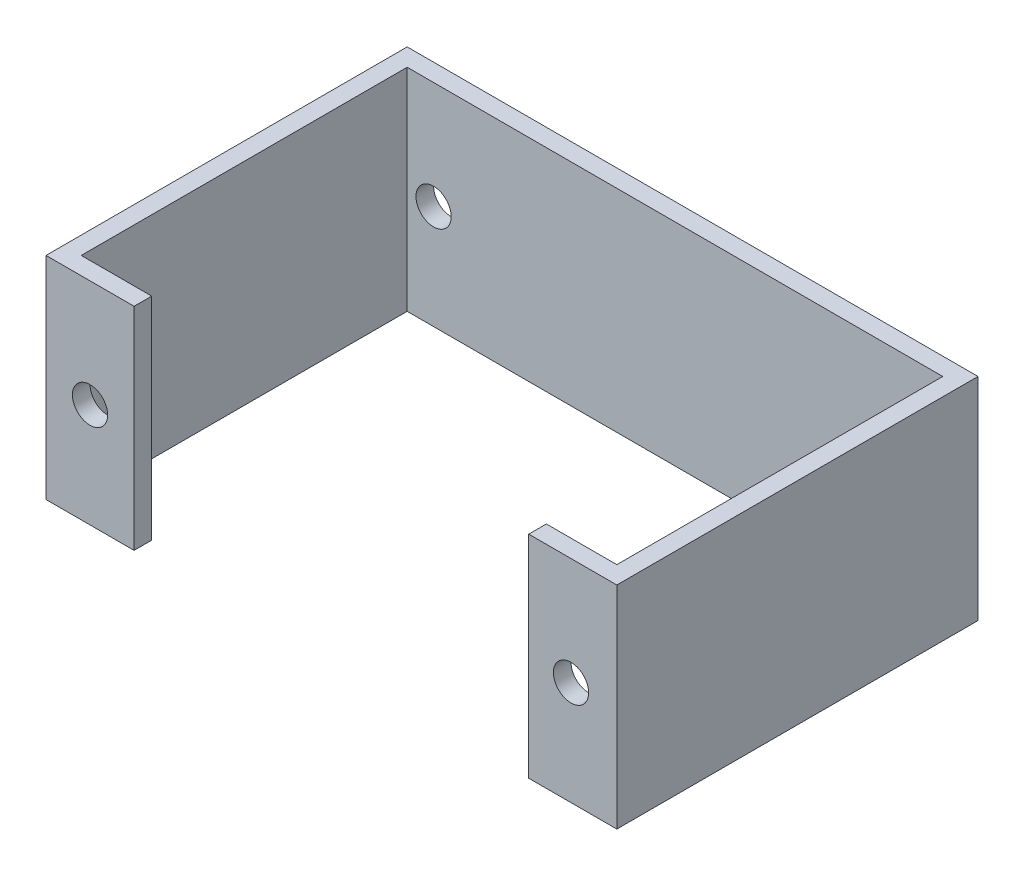
from build123d import *

# Parameters (mm, degrees)
EXTRUDE_THIN1_DEPTH = 12
SKETCH4_R           = 1
CUT_EXTRUDE2_DEPTH  = 40.372706282


with BuildPart() as part:
    # Sketch2 → Extrude-Thin1 (new body)
    with BuildSketch(Plane(origin=(0, 0, 0), x_dir=(1, 0, 0), z_dir=(0, 1, 0))):
        Polygon((4, -18.5), (0, -18.5), (0, 0), (30.4, 0), (30.4, -18.5), (26.4, -18.5), (26.4, -19.5), (31.4, -19.5), (31.4, 1), (-1, 1), (-1, -19.5), (4, -19.5), align=None)
    extrude(amount=EXTRUDE_THIN1_DEPTH)

    # Sketch4 → Cut-Extrude2 (cut, through all)
    with BuildSketch(Plane.XY.offset(19.5)):
        with Locations((28.8, 5.9)):
            Circle(SKETCH4_R)
        with Locations((1.5, 5.9)):
            Circle(SKETCH4_R)
    extrude(amount=-CUT_EXTRUDE2_DEPTH, mode=Mode.SUBTRACT)


solid = part.part
